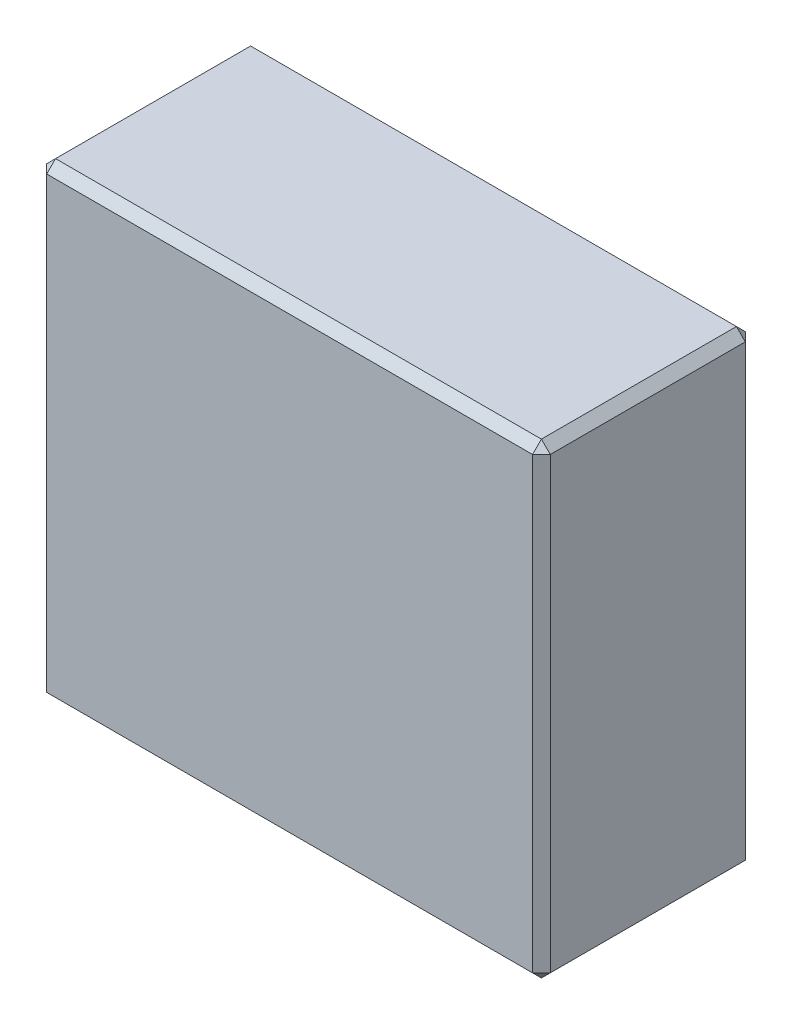
from build123d import *

# Parameters (mm, degrees)
SKETCH1_W           = 180.34
SKETCH1_H           = 76.2
BOSS_EXTRUDE1_DEPTH = 83.566
CHAMFER1_SIZE       = 3.175


with BuildPart() as part:
    # Sketch1 → Boss-Extrude1 (new, symmetric)
    with BuildSketch(Plane(origin=(0, 0, 0), x_dir=(1, 0, 0), z_dir=(0, 1, 0))):
        Rectangle(SKETCH1_W, SKETCH1_H)
    extrude(amount=BOSS_EXTRUDE1_DEPTH, both=True)

    # Chamfer1
    chamfer1_edges = [part.edges().sort_by_distance(p)[0] for p in [
        (90.17, -83.566, 0),
        (0, -83.566, -38.1),
        (-90.17, -83.566, 0),
        (0, 83.566, -38.1),
        (90.17, 83.566, 0),
        (0, 83.566, 38.1),
        (-90.17, 83.566, 0),
        (0, -83.566, 38.1),
        (-90.17, 0, -38.1),
        (90.17, 0, -38.1),
        (90.17, 0, 38.1),
        (-90.17, 0, 38.1),
    ]]
    chamfer(chamfer1_edges, length=CHAMFER1_SIZE)


solid = part.part
